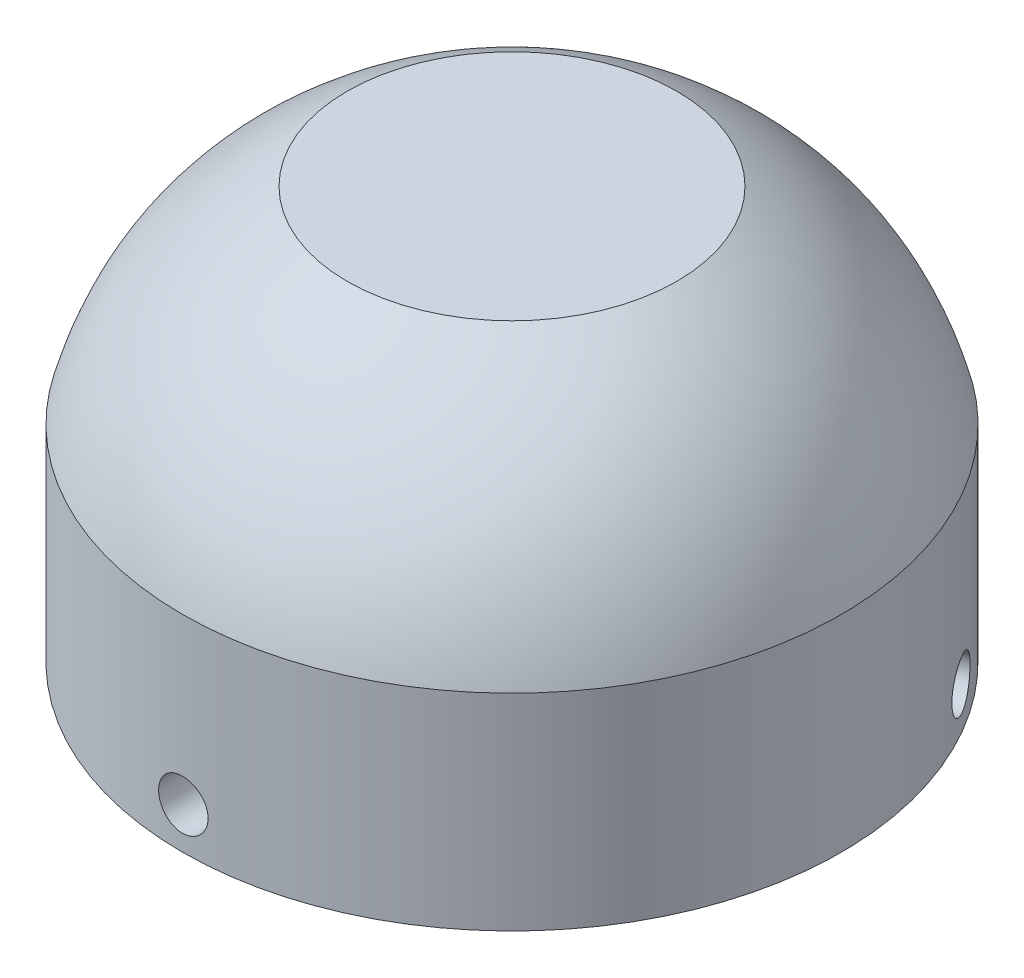
from build123d import *

# Parameters (mm, degrees)
CUT_EXTRUDE1_REACH      = 96.34
CUT_EXTRUDE1_END_RADIUS = 35
SKETCH2_R               = 3
CIRPATTERN1_COUNT       = 3


with BuildPart() as part:
    # Sketch1 → Revolve1 (revolve)
    with BuildSketch(Plane.XY, mode=Mode.PRIVATE) as revolve1_sk:
        with BuildLine():
            Line((-20, 30), (0, 30))
            Line((0, 30), (0, 22.928932188))
            Line((0, 22.928932188), (-20, 22.928932188))
            add(Edge.make_bspline(
                [(-20, 22.928932188), (-32.99251078, 14.579736434), (-35, 0)],
                knots=[0, 0, 0, 1, 1, 1], degree=2))
            Line((-35, 0), (-35, -20))
            Line((-35, -20), (-40, -20))
            Line((-40, -20), (-40, 0))
            Line((-40, 0), (-40, 5))
            add(Edge.make_bspline(
                [(-20, 30), (-35.448934618, 21.981430701), (-40, 5)],
                knots=[0, 0, 0, 1, 1, 1], degree=2))
        make_face()
    revolve(revolve1_sk.sketch.rotate(Axis((0, -63.953488372, 0), (0, 1, 0)), 270), axis=Axis((0, -63.953488372, 0), (0, 1, 0)))

    # Cut-Extrude1: up to this cylinder (the profile starts outside it)
    cut_extrude1_end = Plane(origin=(0, -15, 0), z_dir=(0, -1, 0)) * Cylinder(CUT_EXTRUDE1_END_RADIUS, 263.68, mode=Mode.PRIVATE)
    # Sketch2 → Cut-Extrude1 (cut, up to the surface)
    with BuildSketch(Plane.XY.offset(40), mode=Mode.PRIVATE) as cut_extrude1_sk1:
        with Locations((0, -15)):
            Circle(SKETCH2_R)
    cut_extrude1_tool1 = extrude(cut_extrude1_sk1.sketch, amount=-CUT_EXTRUDE1_REACH, mode=Mode.PRIVATE) - cut_extrude1_end
    cut_extrude1 = cut_extrude1_tool1.solids().sort_by_distance((0, -15, 40))[0]
    add(cut_extrude1, mode=Mode.SUBTRACT)

    # CirPattern1: Cut-Extrude1 ×3 about axis
    cirpattern1_axis = Axis((0, 5, 0), (0, -1, 0))
    for i in range(1, CIRPATTERN1_COUNT):
        add(cut_extrude1.rotate(cirpattern1_axis, i * 360 / CIRPATTERN1_COUNT), mode=Mode.SUBTRACT)


solid = part.part
